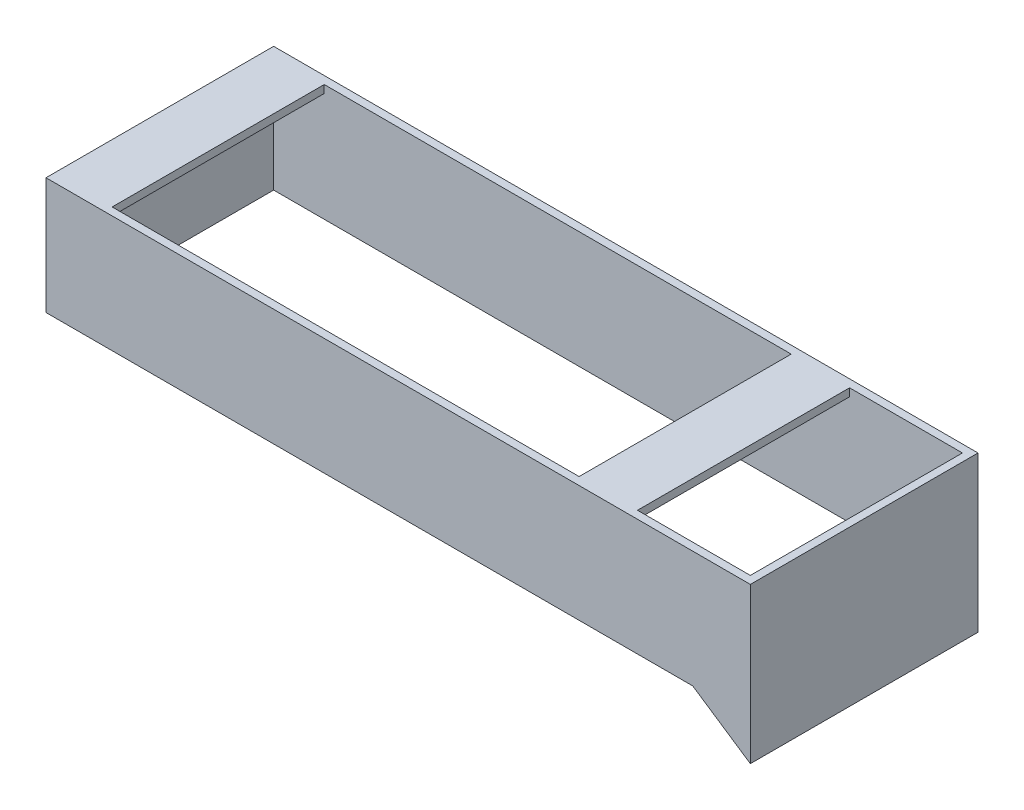
from build123d import *

# Parameters (mm, degrees)
SKETCH_2_W          = 181
SKETCH_2_H          = 58.5
SKETCH_2_W_2        = 177
SKETCH_2_H_2        = 54.5
EXTRUDE_1_DEPTH     = 30
SKETCH_3_W          = 14.8
SKETCH_3_H          = 58.5
EXTRUDE_2_DEPTH     = 9.9
SKETCH_5_W          = 12.8
SKETCH_5_H          = 54.5
CUT_EXTRUDE_1_DEPTH = 9.9
CUT_EXTRUDE_2_DEPTH = 1000
SKETCH_7_W          = 15
SKETCH_7_H          = 58.5
EXTRUDE_3_DEPTH     = 2


with BuildPart() as part:
    # Эскиз2 → Бобышка-Вытянуть1 (new body)
    with BuildSketch(Plane(origin=(0, 0, 0), x_dir=(1, 0, 0), z_dir=(0, 1, 0))):
        Rectangle(SKETCH_2_W, SKETCH_2_H)
        Rectangle(SKETCH_2_W_2, SKETCH_2_H_2, mode=Mode.SUBTRACT)
    extrude(amount=EXTRUDE_1_DEPTH)

    # Эскиз3 → Бобышка-Вытянуть2 (add)
    with BuildSketch(Plane.XZ):
        with Locations((83.1, 0)):
            Rectangle(SKETCH_3_W, SKETCH_3_H)
    extrude(amount=EXTRUDE_2_DEPTH)

    # Эскиз5 → Вырез-Вытянуть1 (cut)
    with BuildSketch(Plane(origin=(0, 0, 0), x_dir=(1, 0, 0), z_dir=(0, 1, 0))):
        with Locations((82.1, 0)):
            Rectangle(SKETCH_5_W, SKETCH_5_H)
    extrude(amount=-CUT_EXTRUDE_1_DEPTH, mode=Mode.SUBTRACT)

    # Эскиз6 → Вырез-Вытянуть2 (cut)
    with BuildSketch(Plane(origin=(0, 0, -29.25), x_dir=(-1, 0, 0), z_dir=(0, 0, -1))):
        Polygon((-90.5, -9.9), (-75.7, 0), (-75.7, -9.9), align=None)
    extrude(amount=-CUT_EXTRUDE_2_DEPTH, mode=Mode.SUBTRACT)

    # Эскиз7 → Бобышка-Вытянуть3 (add)
    with BuildSketch(Plane(origin=(0, 30, 0), x_dir=(1, 0, 0), z_dir=(0, 1, 0))):
        with Locations((-83, 0)):
            Rectangle(SKETCH_7_W, SKETCH_7_H)
        with Locations((51.997710559, 0)):
            Rectangle(SKETCH_7_W, SKETCH_7_H)
    extrude(amount=-EXTRUDE_3_DEPTH)


solid = part.part
